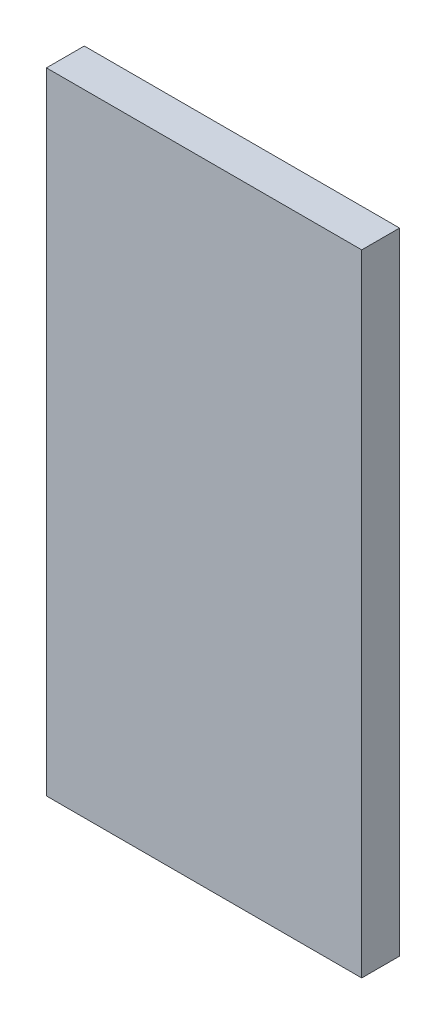
from build123d import *

# Parameters (mm, degrees)
SKIZZE1_W                       = 0.25
SKIZZE1_H                       = 0.5
AUFSATZ_LINEAR_AUSTRAGEN1_DEPTH = 0.03


with BuildPart() as part:
    # Skizze1 → Aufsatz-Linear austragen1 (new body)
    with BuildSketch(Plane.XY):
        Rectangle(SKIZZE1_W, SKIZZE1_H)
    extrude(amount=AUFSATZ_LINEAR_AUSTRAGEN1_DEPTH)


solid = part.part
